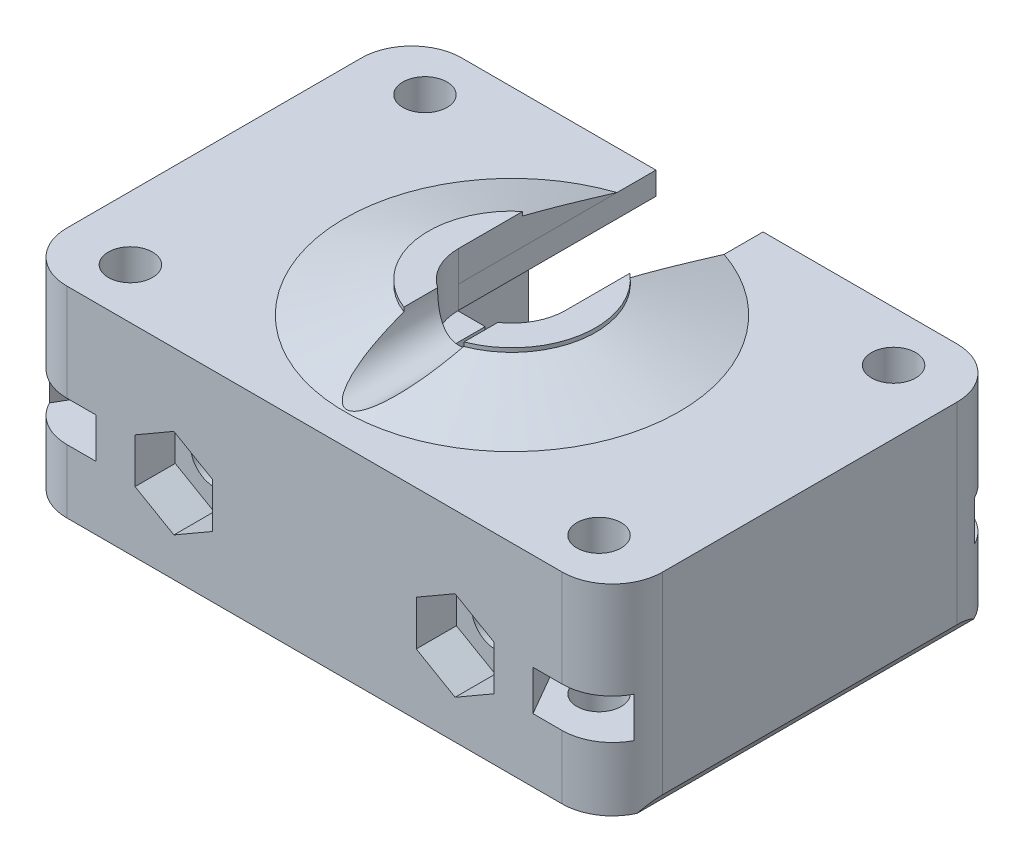
from build123d import *

# Parameters (mm, degrees)
ESBO_O1_R                   = 1.65
RESSALTO_EXTRUS_O1_DEPTH    = 17
CORTE_EXTRUS_O2_DEPTH       = 32.941352507
CORTE_EXTRUS_O3_DEPTH       = 5.5
CORTE_EXTRUS_O4_DEPTH       = 15.3
CORTE_EXTRUS_O5_DEPTH       = 4.3
ESBO_O6_R                   = 12.5
ESBO_O7_R                   = 6.25
ESBO_O8_R                   = 6.25
RESSALTO_EXTRUS_O2_DEPTH    = 0.3
CORTE_EXTRUS_O6_DEPTH       = 32.941352507
CORTE_EXTRUS_O7_DEPTH       = 43.175111144
CORTE_EXTRUS_O7_DEPTH_BACK  = 43.175111144
ESBO_O10_R                  = 2.25
CORTE_EXTRUS_O14_DEPTH      = 34.222582739
CORTE_EXTRUS_O14_DEPTH_BACK = 34.222582739
CORTE_EXTRUS_O17_DEPTH      = 42.686958439
CORTE_EXTRUS_O17_DEPTH_BACK = 42.686958439
CORTE_EXTRUS_O18_DEPTH      = 1.5
ESBO_O22_W                  = 73.531346764
ESBO_O22_H                  = 29.602386944
CORTE_EXTRUS_O19_DEPTH      = 2
ESBO_O28_W                  = 27
ESBO_O28_H                  = 13.3
CORTE_EXTRUS_O22_DEPTH      = 10.5
ESBO_O27_R                  = 1.75
CORTE_EXTRUS_O23_DEPTH      = 42.686958439
CORTE_EXTRUS_O24_DEPTH      = 3


with BuildPart() as part:
    # Esboço1 → Ressalto-extrusão1 (new body)
    with BuildSketch(Plane(origin=(0, 0, 0), x_dir=(1, 0, 0), z_dir=(0, 1, 0))):
        with BuildLine():
            Line((-18.5, -15), (18.5, -15))
            ThreePointArc((18.5, -15), (21.328427125, -13.828427125), (22.5, -11))
            Line((22.5, -11), (22.5, 11))
            ThreePointArc((22.5, 11), (21.328427125, 13.828427125), (18.5, 15))
            Line((18.5, 15), (-18.5, 15))
            ThreePointArc((-18.5, 15), (-21.328427125, 13.828427125), (-22.5, 11))
            Line((-22.5, 11), (-22.5, -11))
            ThreePointArc((-22.5, -11), (-21.328427125, -13.828427125), (-18.5, -15))
        make_face()
        with Locations(Location((-17.5, -11, 0), (0, 0, 270))):
            Circle(ESBO_O1_R, mode=Mode.SUBTRACT)
        with Locations(Location((-17.5, 11, 0), (0, 0, 270))):
            Circle(ESBO_O1_R, mode=Mode.SUBTRACT)
        with Locations(Location((17.5, -11, 0), (0, 0, 270))):
            Circle(ESBO_O1_R, mode=Mode.SUBTRACT)
        with Locations(Location((17.5, 11, 0), (0, 0, 270))):
            Circle(ESBO_O1_R, mode=Mode.SUBTRACT)
    extrude(amount=RESSALTO_EXTRUS_O1_DEPTH)

    # Esboço3 → Corte-extrusão2 (cut, through all)
    with BuildSketch(Plane.XZ):
        with BuildLine():
            Line((-4, -15), (4, -15))
            Line((4, -15), (4, 0))
            ThreePointArc((4, 0), (0, 4), (-4, 0))
            Line((-4, 0), (-4, -15))
        make_face()
    extrude(amount=-CORTE_EXTRUS_O2_DEPTH, mode=Mode.SUBTRACT)

    # Esboço4 → Corte-extrusão3 (cut)
    with BuildSketch(Plane.XZ):
        with BuildLine():
            Line((-8.48, -15), (-8.48, 0))
            ThreePointArc((-8.48, 0), (0, 8.48), (8.48, 0))
            Line((8.48, 0), (8.48, -15))
            Line((8.48, -15), (-8.48, -15))
        make_face()
    extrude(amount=-CORTE_EXTRUS_O3_DEPTH, mode=Mode.SUBTRACT)

    # Esboço4<3> → Corte-extrusão4 (cut)
    with BuildSketch(Plane.XZ):
        with BuildLine():
            Line((-6.25, 0), (-6.25, -15))
            Line((-6.25, -15), (-4, -15))
            Line((-4, -15), (-4, 0))
            ThreePointArc((-4, 0), (0, 4), (4, 0))
            Line((4, 0), (4, -15))
            Line((4, -15), (6.25, -15))
            Line((6.25, -15), (6.25, 0))
            ThreePointArc((6.25, 0), (0, 6.25), (-6.25, 0))
        make_face()
    extrude(amount=-CORTE_EXTRUS_O4_DEPTH, mode=Mode.SUBTRACT)

    # Esboço5 → Corte-extrusão5 (cut)
    with BuildSketch(Plane.XZ.offset(-15.3)):
        with BuildLine():
            Line((-8.48, -15), (-8.48, 0.052643862))
            ThreePointArc((-8.48, 0.052643862), (0, 8.532643862), (8.48, 0.052643862))
            Line((8.48, 0.052643862), (8.48, -15))
            Line((8.48, -15), (-8.48, -15))
        make_face()
    extrude(amount=CORTE_EXTRUS_O5_DEPTH, mode=Mode.SUBTRACT)

    # Esboço6 → Loft1 section 0
    with BuildSketch(Plane(origin=(0, 17, 0), x_dir=(1, 0, 0), z_dir=(0, 1, 0))):
        Circle(ESBO_O6_R)
    # Esboço7 → Loft1 section 1
    with BuildSketch(Plane(origin=(0, 19, 0), x_dir=(1, 0, 0), z_dir=(0, 1, 0))):
        Circle(ESBO_O7_R)
    loft()

    # Esboço8 → Ressalto-extrusão2 (add)
    with BuildSketch(Plane(origin=(0, 19, 0), x_dir=(1, 0, 0), z_dir=(0, 1, 0))):
        with Locations(Location((0, 0, 0), (0, 0, 270))):
            Circle(ESBO_O8_R)
    extrude(amount=RESSALTO_EXTRUS_O2_DEPTH)

    # Esboço9 → Corte-extrusão6 (cut, through all)
    with BuildSketch(Plane.XZ.offset(-17)):
        with BuildLine():
            Line((-4, 0), (-3.999987243, -11.842772672))
            ThreePointArc((-3.999987243, -11.842772672), (2.212e-06, -12.500043117), (3.999990323, -11.842764489))
            Line((3.999990323, -11.842764489), (4, 0))
            ThreePointArc((4, 0), (0, 4), (-4, 0))
        make_face()
    extrude(amount=-CORTE_EXTRUS_O6_DEPTH, mode=Mode.SUBTRACT)

    # Esboço10 → Corte-extrusão7 (cut, two sides: drawn at the far end of the back side and taken through both)
    with BuildSketch(Plane(origin=(0, 0, -15), x_dir=(-1, 0, 0), z_dir=(0, 0, -1)).offset(-CORTE_EXTRUS_O7_DEPTH_BACK)):
        with Locations((0, 19.3)):
            Circle(ESBO_O10_R)
    extrude(amount=CORTE_EXTRUS_O7_DEPTH + CORTE_EXTRUS_O7_DEPTH_BACK, mode=Mode.SUBTRACT)

    # Esboço17 → Corte-extrusão14 (cut, two sides: drawn at the far end of the back side and taken through both)
    with BuildSketch(Plane.XZ.offset(-CORTE_EXTRUS_O14_DEPTH_BACK)):
        with BuildLine():
            Line((-8.48, -15), (8.48, -15))
            Line((8.48, -15), (18.5, -15))
            ThreePointArc((18.5, -15), (21.328427125, -13.828427125), (22.5, -11))
            Line((22.5, -11), (22.5, 11))
            ThreePointArc((22.5, 11), (21.328427125, 13.828427125), (18.5, 15))
            Line((18.5, 15), (-18.5, 15))
            ThreePointArc((-18.5, 15), (-21.328427125, 13.828427125), (-22.5, 11))
            Line((-22.5, 11), (-22.5, -11))
            ThreePointArc((-22.5, -11), (-21.328427125, -13.828427125), (-18.5, -15))
            Line((-18.5, -15), (-8.48, -15))
        make_face()
        with BuildLine():
            Line((8.48, -14.75), (18.5, -14.75))
            ThreePointArc((18.5, -14.75), (21.151650429, -13.651650429), (22.25, -11))
            Line((22.25, -11), (22.25, 11))
            ThreePointArc((22.25, 11), (21.151650429, 13.651650429), (18.5, 14.75))
            Line((18.5, 14.75), (-18.5, 14.75))
            ThreePointArc((-18.5, 14.75), (-21.151650429, 13.651650429), (-22.25, 11))
            Line((-22.25, 11), (-22.25, -11))
            ThreePointArc((-22.25, -11), (-21.151650429, -13.651650429), (-18.5, -14.75))
            Line((-18.5, -14.75), (-8.48, -14.75))
            Line((-8.48, -14.75), (8.48, -14.75))
        make_face(mode=Mode.SUBTRACT)
    extrude(amount=CORTE_EXTRUS_O14_DEPTH + CORTE_EXTRUS_O14_DEPTH_BACK, mode=Mode.SUBTRACT)

    # Esboço20 → Corte-extrusão17 (cut, two sides: drawn at the far end of the back side and taken through both)
    with BuildSketch(Plane.XY.offset(14.75).offset(-CORTE_EXTRUS_O17_DEPTH_BACK)):
        Polygon((-20.75, 0), (-22.25, 2.598076211), (-22.25, 0), align=None)
        Polygon((20.75, 0), (22.25, 2.598076211), (22.25, 0), align=None)
    extrude(amount=CORTE_EXTRUS_O17_DEPTH + CORTE_EXTRUS_O17_DEPTH_BACK, mode=Mode.SUBTRACT)

    # Esboço21 → Corte-extrusão18 (cut, symmetric)
    with BuildSketch(Plane(origin=(0, 8.25, 0), x_dir=(1, 0, 0), z_dir=(0, 1, 0))):
        Polygon((-20.848631561, 11), (-26.366704658, 20.557582963), (-21.343757316, 23.457582963), (-15.825684219, 13.9), (-14.151368439, 11), (-15.825684219, 8.1), (-19.174315781, 8.1), align=None)
        Polygon((19.174315781, 8.1), (20.848631561, 11), (26.085179504, 20.069967093), (21.158487208, 23.136685723), (15.825684219, 13.9), (14.151368439, 11), (15.825684219, 8.1), align=None)
        Polygon((15.825684219, -8.1), (14.151368439, -11), (15.825684219, -13.9), (19.678983152, -20.574109528), (25.513300663, -19.079443885), (20.848631561, -11), (19.174315781, -8.1), align=None)
        Polygon((-19.174315781, -8.1), (-20.848631561, -11), (-25.445111293, -18.961336431), (-20.050312904, -21.217271525), (-15.825684219, -13.9), (-14.151368439, -11), (-15.825684219, -8.1), align=None)
    extrude(amount=CORTE_EXTRUS_O18_DEPTH, both=True, mode=Mode.SUBTRACT)

    # Esboço22 → Corte-extrusão19 (cut)
    with BuildSketch(Plane.XZ):
        Rectangle(ESBO_O22_W, ESBO_O22_H)
    extrude(amount=-CORTE_EXTRUS_O19_DEPTH, mode=Mode.SUBTRACT)

    # Esboço28 → Corte-extrusão22 (cut)
    with BuildSketch(Plane(origin=(0, 0, -14.75), x_dir=(-1, 0, 0), z_dir=(0, 0, -1))):
        with Locations((0, 8.65)):
            Rectangle(ESBO_O28_W, ESBO_O28_H)
    extrude(amount=-CORTE_EXTRUS_O22_DEPTH, mode=Mode.SUBTRACT)

    # Esboço27 → Corte-extrusão23 (cut, through all)
    with BuildSketch(Plane(origin=(0, 0, -14.75), x_dir=(-1, 0, 0), z_dir=(0, 0, -1))):
        with Locations((-10.5, 8.25)):
            Circle(ESBO_O27_R)
        with Locations((10.5, 8.25)):
            Circle(ESBO_O27_R)
    extrude(amount=-CORTE_EXTRUS_O23_DEPTH, mode=Mode.SUBTRACT)

    # Esboço29 → Corte-extrusão24 (cut)
    with BuildSketch(Plane.XY.offset(14.75)):
        Polygon((-7.6, 9.924315781), (-10.5, 11.598631561), (-13.4, 9.924315781), (-13.4, 6.575684219), (-10.5, 4.901368439), (-7.6, 6.575684219), align=None)
        Polygon((10.5, 11.598631561), (7.6, 9.924315781), (7.6, 6.575684219), (10.5, 4.901368439), (13.4, 6.575684219), (13.4, 9.924315781), align=None)
    extrude(amount=-CORTE_EXTRUS_O24_DEPTH, mode=Mode.SUBTRACT)


solid = part.part
